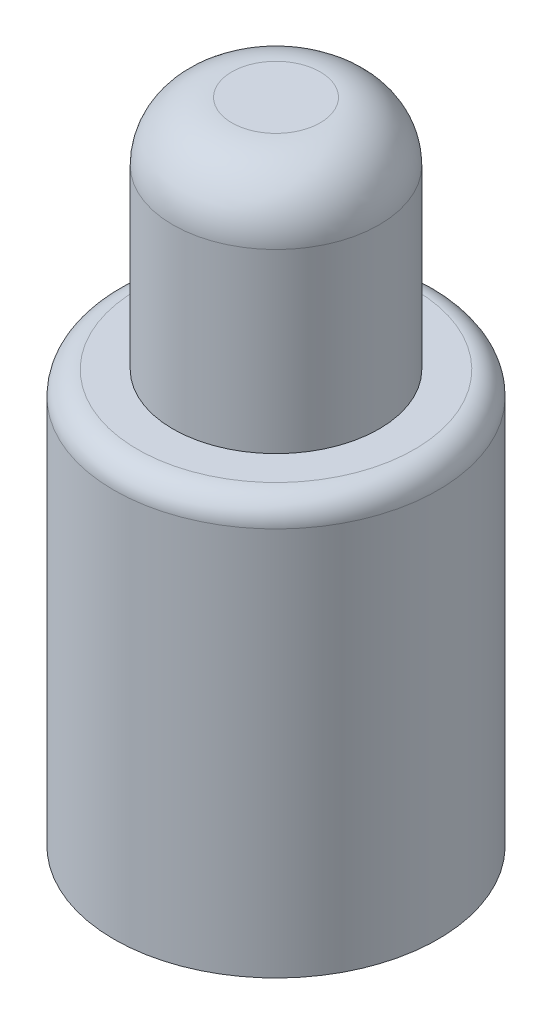
from build123d import *

# Parameters (mm, degrees)
FILLET1_R = 1
FILLET2_R = 0.4


with BuildPart() as part:
    # Sketch1 → Revolve1 (revolve)
    with BuildSketch(Plane.XY, mode=Mode.PRIVATE) as revolve1_sk:
        Polygon((0, 0), (2.75, 0), (2.75, 7), (1.75, 7), (1.75, 11), (0, 11), align=None)
    revolve(revolve1_sk.sketch.rotate(Axis((0, 0, 0), (0, -1, 0)), 90), axis=Axis((0, 0, 0), (0, -1, 0)))

    # Fillet1
    fillet1_edges = [part.edges().sort_by_distance(p)[0] for p in [
        (0, 11, -1.75),
    ]]
    fillet(fillet1_edges, radius=FILLET1_R)

    # Fillet2
    fillet2_edges = [part.edges().sort_by_distance(p)[0] for p in [
        (0, 7, -2.75),
    ]]
    fillet(fillet2_edges, radius=FILLET2_R)


solid = part.part
